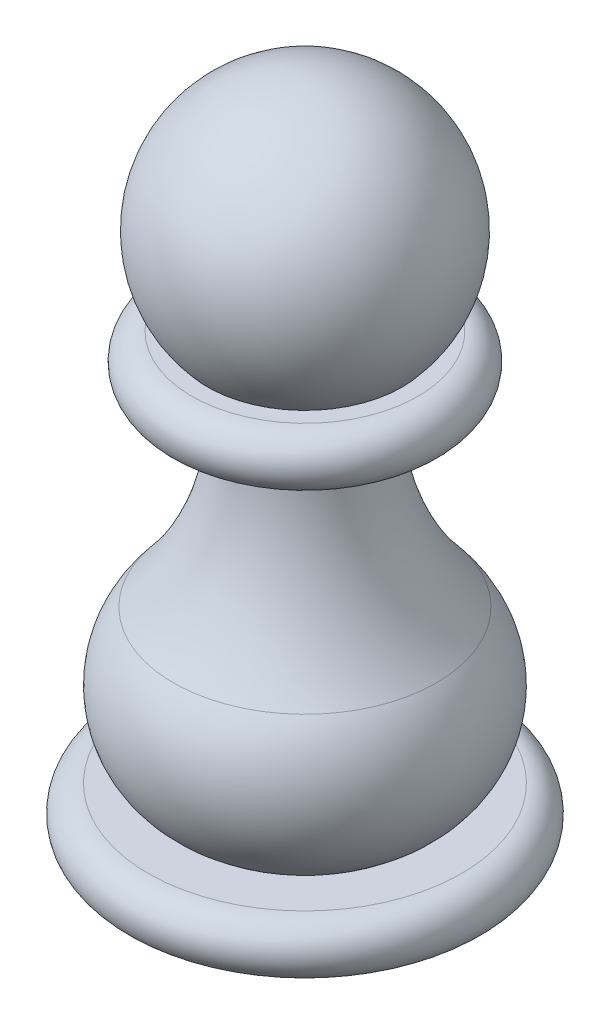
from build123d import *


with BuildPart() as part:
    # Sketch1 → Revolve4 (revolve)
    with BuildSketch(Plane.XY, mode=Mode.PRIVATE) as revolve4_sk:
        with BuildLine():
            Line((5.590169944, 25.5), (6.5, 25.5))
            ThreePointArc((6.5, 25.5), (8, 24), (6.5, 22.5))
            Line((6.5, 22.5), (4, 22.5))
            ThreePointArc((4, 22.5), (4.731529648, 16.786775193), (7.562140976, 11.770430623))
            ThreePointArc((7.562140976, 11.770430623), (8.956479045, 7.152039153), (6.5, 3))
            Line((6.5, 3), (9, 3))
            ThreePointArc((9, 3), (10.5, 1.5), (9, 0))
            Line((9, 0), (0, 0))
            Line((0, 0), (0, 38))
            ThreePointArc((0, 38), (6.846531969, 33.561862178), (5.590169944, 25.5))
        make_face()
    revolve(revolve4_sk.sketch.rotate(Axis((0, 38, 0), (0, -1, 0)), 180), axis=Axis((0, 38, 0), (0, -1, 0)))


solid = part.part
